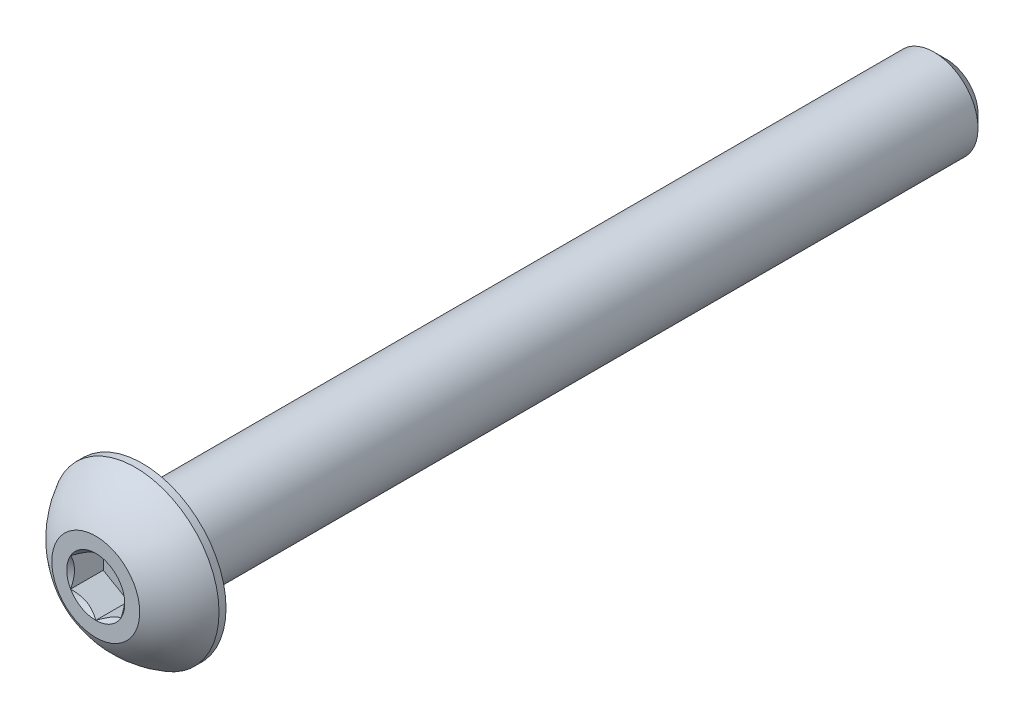
from build123d import *

# Parameters (mm, degrees)
SKETCH1_W          = 38.1
SKETCH1_H          = 2.0828
CHAMFER1_SIZE      = 0.5953125
CUT_EXTRUDE2_DEPTH = 1.54686


with BuildPart() as part:
    # Sketch1 → Revolve1 (revolve)
    with BuildSketch(Plane(origin=(0, 0, 0), x_dir=(0, 0, -1), z_dir=(1, 0, 0))):
        with Locations((21.2598, 1.0414)):
            Rectangle(SKETCH1_W, SKETCH1_H)
    revolve(axis=Axis((0, 0, -40.3098), (0, 0, 1)))

    # Chamfer1
    chamfer1_edges = [part.edges().sort_by_distance(p)[0] for p in [
        (0, -2.0828, -40.3098),
    ]]
    chamfer(chamfer1_edges, length=CHAMFER1_SIZE)

    # Sketch7 → Revolve2 (revolve)
    with BuildSketch(Plane(origin=(0, 0, 0), x_dir=(0, 0, -1), z_dir=(1, 0, 0))):
        with BuildLine():
            Line((1.87833, 3.9624), (2.2098, 3.9624))
            Line((2.2098, 3.9624), (2.2098, 0))
            Line((2.2098, 0), (0, 0))
            Line((0, 0), (0, 2.0828))
            ThreePointArc((0, 2.0828), (0.796523813, 3.165144808), (1.87833, 3.9624))
        make_face()
    revolve(axis=Axis((0, 0, 0), (0, 0, -1)))

    # Sketch5 → Cut-Extrude2 (cut)
    with BuildSketch(Plane.XY):
        Polygon((1.190625, -0.687407664), (1.190625, 0.687407664), (0, 1.374815329), (-1.190625, 0.687407664), (-1.190625, -0.687407664), (0, -1.374815329), align=None)
    extrude(amount=-CUT_EXTRUDE2_DEPTH, mode=Mode.SUBTRACT)

    # Cut-Extrude3 cone 1 section (through the dimple's axis) → Cut-Extrude3 (revolve, cut)
    with BuildSketch(Plane(origin=(0, 0, 0), x_dir=(0, -1, 0), z_dir=(1, 0, 0))):
        Polygon((0, 0), (1.374815329, 0), (0, 1.374815329), align=None)
    revolve(axis=Axis((0, 0, 0), (0, 0, -1)), mode=Mode.SUBTRACT)


solid = part.part
